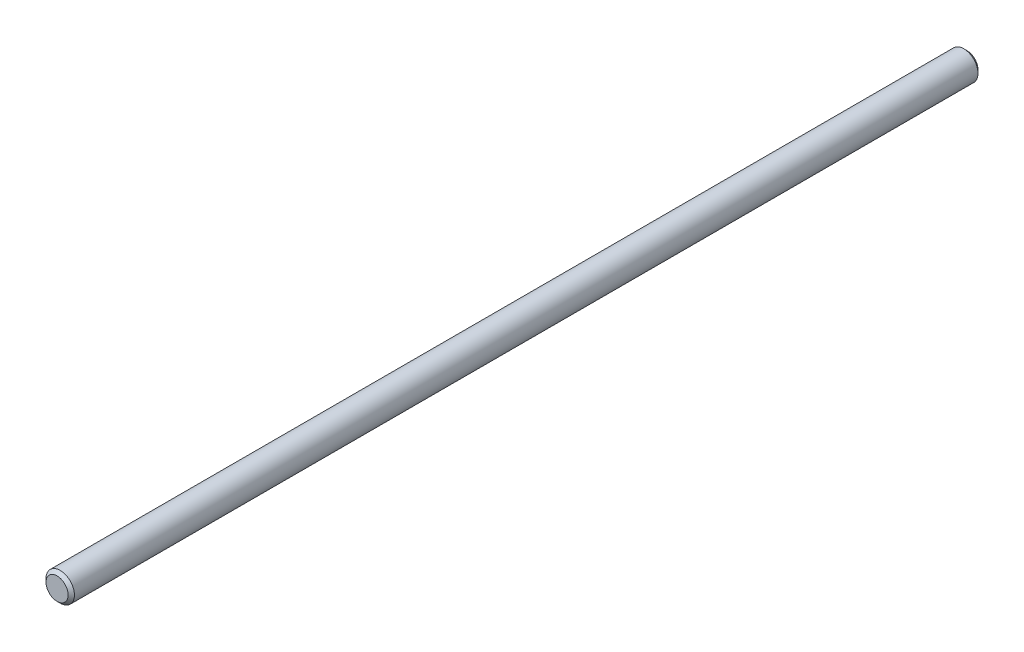
from build123d import *


with BuildPart() as part:
    # Sketch2 → Revolve1 (revolve)
    with BuildSketch(Plane(origin=(0, 0, 0), x_dir=(0, 0, -1), z_dir=(1, 0, 0)), mode=Mode.PRIVATE) as revolve1_sk:
        Polygon((-152.4, 0), (152.4, 0), (152.4, 3.704166667), (151.341666667, 4.7625), (-151.341666667, 4.7625), (-152.4, 3.704166667), align=None)
    revolve(revolve1_sk.sketch.rotate(Axis((0, 0, 152.4), (0, 0, -1)), 90), axis=Axis((0, 0, 152.4), (0, 0, -1)))


solid = part.part
